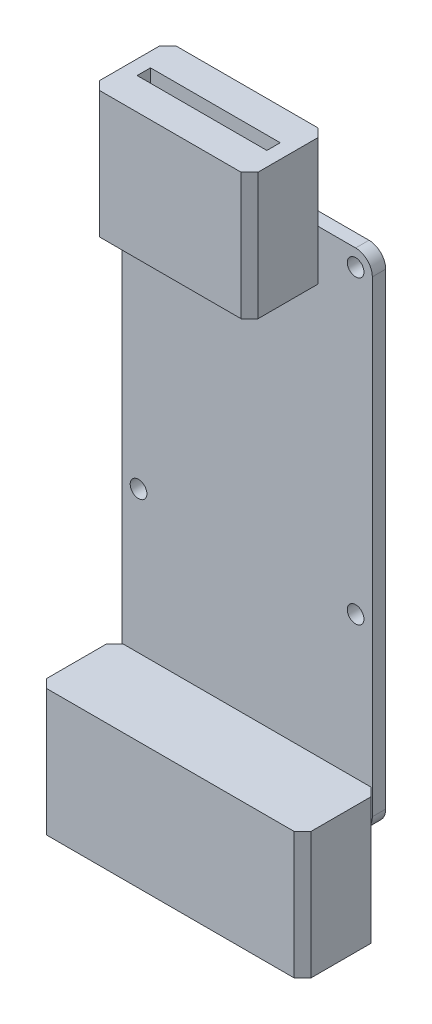
from build123d import *

# Parameters (mm, degrees)
SKETCH_1_R          = 1
EXTRUDE_1_DEPTH     = 1.6
SKETCH_2_R          = 1
CUT_EXTRUDE_1_DEPTH = 1.6
EXTRUDE_START       = 1.6
SKETCH_4_W          = 18.99
SKETCH_4_H          = 15.2
EXTRUDE_2_DEPTH     = 9.2
CUT_EXTRUDE_START   = 42.7
CUT_EXTRUDE_2_DEPTH = 15.2
SKETCH_6_W          = 15.54
SKETCH_6_H          = 1.6
CUT_EXTRUDE_3_DEPTH = 9
SKETCH_7_W          = 31.69
SKETCH_7_H          = 15.2
EXTRUDE_3_DEPTH     = 9.2
CUT_EXTRUDE_START_2 = -37.7
SKETCH_9_W          = 28.24
SKETCH_9_H          = 1.6
CUT_EXTRUDE_5_DEPTH = 9
CUT_EXTRUDE_6_DEPTH = 15.2


with BuildPart() as part:
    # 草图1 → 凸台-拉伸1 (new body)
    with BuildSketch(Plane.XY):
        with BuildLine():
            Line((-13, 32.5), (13, 32.5))
            ThreePointArc((13, 32.5), (14.414213562, 31.914213562), (15, 30.5))
            Line((15, 30.5), (15, -25.5))
            ThreePointArc((15, -25.5), (14.414213562, -26.914213562), (13, -27.5))
            Line((13, -27.5), (-13, -27.5))
            ThreePointArc((-13, -27.5), (-14.414213562, -26.914213562), (-15, -25.5))
            Line((-15, -25.5), (-15, 30.5))
            ThreePointArc((-15, 30.5), (-14.414213562, 31.914213562), (-13, 32.5))
        make_face()
        with Locations((-13, 30.5)):
            Circle(SKETCH_1_R, mode=Mode.SUBTRACT)
        with Locations((13, 30.5)):
            Circle(SKETCH_1_R, mode=Mode.SUBTRACT)
    extrude(amount=EXTRUDE_1_DEPTH)

    # 草图2 → 切除-拉伸1 (cut)
    with BuildSketch(Plane.XY):
        with Locations((-13, -5.5)):
            Circle(SKETCH_2_R)
        with Locations((13, -5.5)):
            Circle(SKETCH_2_R)
    extrude(amount=CUT_EXTRUDE_1_DEPTH, mode=Mode.SUBTRACT)

    # 草图4 → 凸台-拉伸2 (add)
    with BuildSketch(Plane.XY.offset(EXTRUDE_START)):
        with Locations((0, 35.1)):
            Rectangle(SKETCH_4_W, SKETCH_4_H)
    extrude(amount=EXTRUDE_2_DEPTH)

    # 草图5 → 切除-拉伸2 (cut)
    with BuildSketch(Plane(origin=(0, 0, 0), x_dir=(1, 0, 0), z_dir=(0, 1, 0)).offset(CUT_EXTRUDE_START)):
        Polygon((-9.495, -10.8), (-8.495, -10.8), (-9.495, -9.8), align=None)
        Polygon((9.495, -10.8), (8.495, -10.8), (9.495, -9.8), align=None)
        Polygon((9.495, -1.6), (9.495, -2.6), (8.495, -1.6), align=None)
        Polygon((-9.495, -1.6), (-8.495, -1.6), (-9.495, -2.6), align=None)
    extrude(amount=-CUT_EXTRUDE_2_DEPTH, mode=Mode.SUBTRACT)

    # 草图6 → 切除-拉伸3 (cut)
    with BuildSketch(Plane(origin=(0, 0, 0), x_dir=(1, 0, 0), z_dir=(0, 1, 0)).offset(CUT_EXTRUDE_START)):
        with Locations((0, -6.2)):
            Rectangle(SKETCH_6_W, SKETCH_6_H)
    extrude(amount=-CUT_EXTRUDE_3_DEPTH, mode=Mode.SUBTRACT)

    # 草图7 → 凸台-拉伸3 (add)
    with BuildSketch(Plane.XY.offset(EXTRUDE_START)):
        with Locations((0, -30.1)):
            Rectangle(SKETCH_7_W, SKETCH_7_H)
    extrude(amount=EXTRUDE_3_DEPTH)

    # 草图9 → 切除-拉伸5 (cut)
    with BuildSketch(Plane(origin=(0, 0, 0), x_dir=(1, 0, 0), z_dir=(0, 1, 0)).offset(CUT_EXTRUDE_START_2)):
        with Locations((0, -6.2)):
            Rectangle(SKETCH_9_W, SKETCH_9_H)
    extrude(amount=CUT_EXTRUDE_5_DEPTH, mode=Mode.SUBTRACT)

    # 草图10 → 切除-拉伸6 (cut)
    with BuildSketch(Plane(origin=(0, 0, 0), x_dir=(1, 0, 0), z_dir=(0, 1, 0)).offset(CUT_EXTRUDE_START_2)):
        Polygon((15.845, -10.8), (14.845, -10.8), (15.845, -9.8), align=None)
        Polygon((-15.845, -10.8), (-14.845, -10.8), (-15.845, -9.8), align=None)
        Polygon((-15.845, -2.6), (-14.845, -1.6), (-15.845, -1.6), align=None)
        Polygon((15.845, -2.6), (14.845, -1.6), (15.845, -1.6), align=None)
    extrude(amount=CUT_EXTRUDE_6_DEPTH, mode=Mode.SUBTRACT)


solid = part.part
